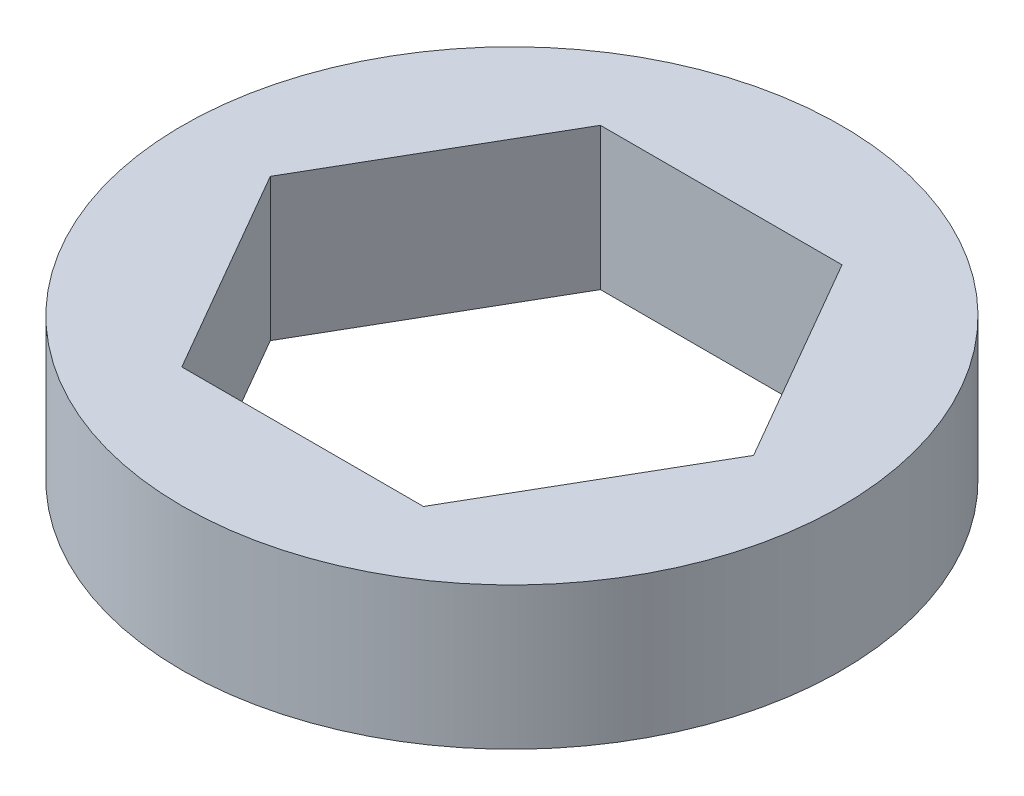
from build123d import *

# Parameters (mm, degrees)
SKETCH1_R           = 10
BOSS_EXTRUDE1_DEPTH = 4.318


with BuildPart() as part:
    # Sketch1 → Boss-Extrude1 (new body)
    with BuildSketch(Plane(origin=(0, 0, 0), x_dir=(1, 0, 0), z_dir=(0, 1, 0))):
        with Locations(Location((0, 0, 0), (0, 0, 270))):
            Circle(SKETCH1_R)
        Polygon((-7.332348419, 0), (-3.666174209, -6.35), (3.666174209, -6.35), (7.332348419, 0), (3.666174209, 6.35), (-3.666174209, 6.35), align=None, mode=Mode.SUBTRACT)
    extrude(amount=BOSS_EXTRUDE1_DEPTH)


solid = part.part
